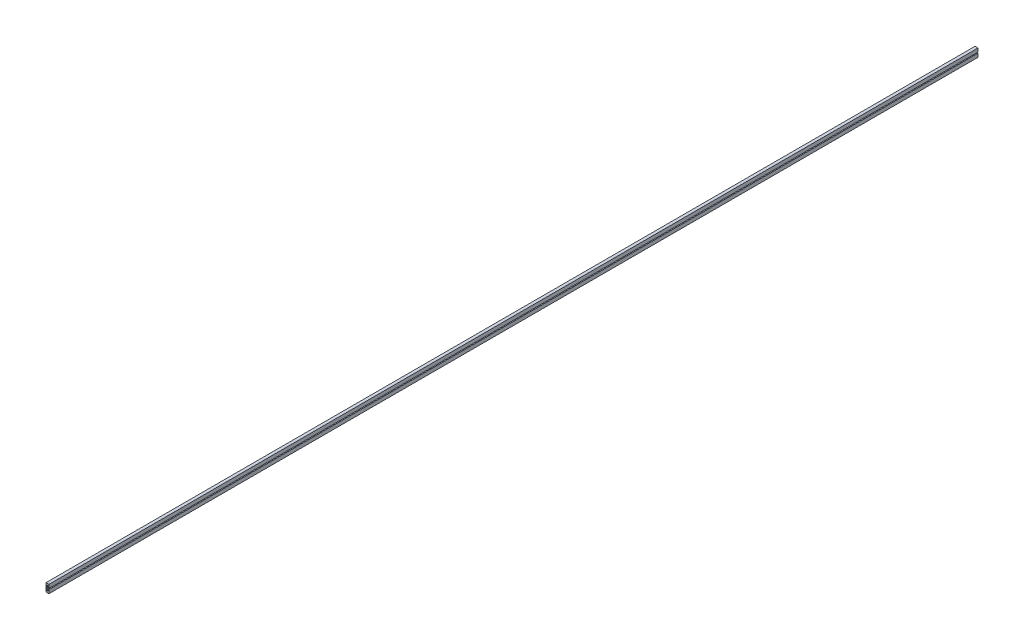
from build123d import *

# Parameters (mm, degrees)
BOSS_EXTRUDE1_DEPTH = 2845


with BuildPart() as part:
    # Sketch5 → Boss-Extrude1 (new body)
    with BuildSketch(Plane.XY):
        Polygon((0, 0), (3, 0), (3, 11), (-6, 11), (-6, -14), (3, -14), (3, -3), (0, -3), (0, -9), (-3, -9), (-3, 6), (0, 6), align=None)
    extrude(amount=BOSS_EXTRUDE1_DEPTH)


solid = part.part
